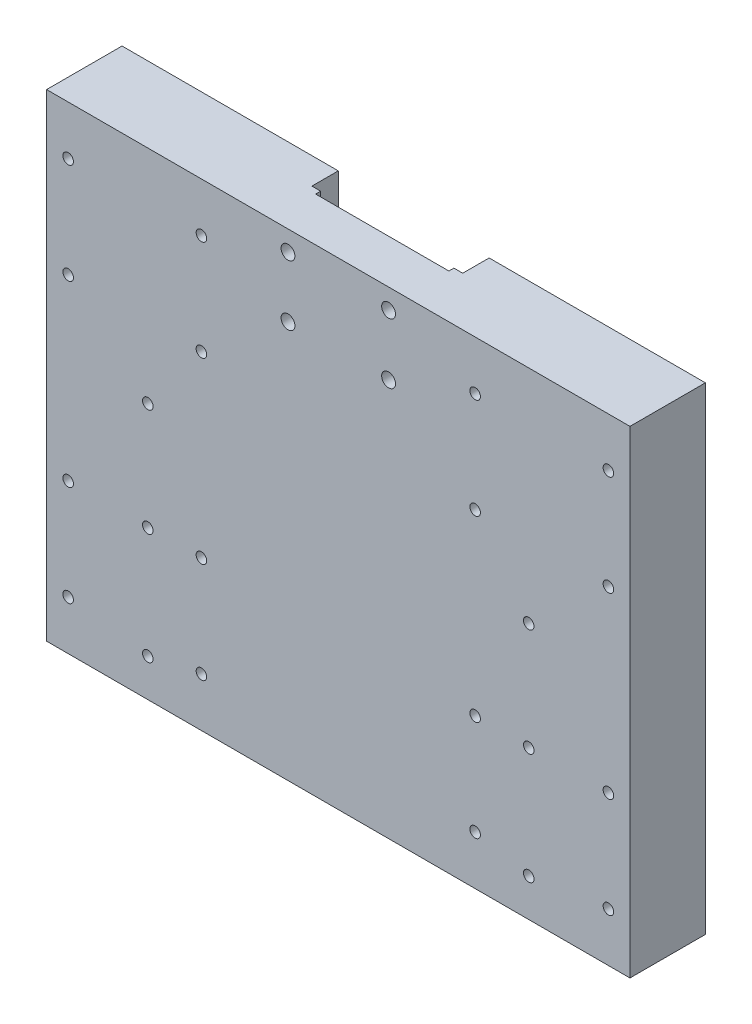
from build123d import *

# Parameters (mm, degrees)
SCHIZZO1_W                   = 232
SCHIZZO1_H                   = 190
ESTRUSIONE_ESTRUSIONE1_DEPTH = 30
SCHIZZO4_W                   = 60
SCHIZZO4_H                   = 10.5
TAGLIO_ESTRUSIONE2_DEPTH     = 225.624130494
TAP_DRILL_FOR_M5_TAP1_D      = 4.2
M5_CLEARANCE_HOLE1_D         = 5.5
TAP_DRILL_FOR_M5_TAP3_D      = 4.2
SKETCH8_W                    = 53
SKETCH8_H                    = 52
CUT_EXTRUDE1_DEPTH           = 2


with BuildPart() as part:
    # Schizzo1 → Estrusione-Estrusione1 (new body)
    with BuildSketch(Plane.XY):
        Rectangle(SCHIZZO1_W, SCHIZZO1_H)
    extrude(amount=ESTRUSIONE_ESTRUSIONE1_DEPTH)

    # Schizzo4 → Taglio-Estrusione2 (cut, through all)
    with BuildSketch(Plane(origin=(0, 95, 0), x_dir=(1, 0, 0), z_dir=(0, 1, 0))):
        with Locations((0, -5.25)):
            Rectangle(SCHIZZO4_W, SCHIZZO4_H)
    extrude(amount=-TAGLIO_ESTRUSIONE2_DEPTH, mode=Mode.SUBTRACT)

    # Tap Drill for M5 Tap1 (through all)
    with Locations(Plane(origin=(0, 0, 0), x_dir=(-1, 0, 0), z_dir=(0, 0, -1))):
        with Locations((-54.428761817, 35.5), (-54.428761817, 75.5), (-107.428761817, 35.5), (-107.428761817, -75.5), (-107.428761817, -35.5), (-54.428761817, -35.5), (-54.428761817, -75.5), (54.428761817, -75.5), (54.428761817, -35.5), (107.428761817, -35.5), (107.428761817, -75.5), (107.428761817, 75.5), (107.428761817, 35.5), (54.428761817, 35.5), (54.428761817, 75.5), (-107.428761817, 75.5)):
            Hole(TAP_DRILL_FOR_M5_TAP1_D / 2)

    # M5 Clearance Hole1 (through all)
    with Locations(Plane.XY.offset(30)):
        with Locations((-20, 87), (20, 87), (20, 63), (-20, 63)):
            Hole(M5_CLEARANCE_HOLE1_D / 2)

    # Tap Drill for M5 Tap3 (through all)
    with Locations(Plane.XY.offset(30)):
        with Locations((-75.75, 7), (-75.75, -80), (75.75, 7), (75.75, -80), (-75.75, -35.79251315), (75.75, -35.79251315)):
            Hole(TAP_DRILL_FOR_M5_TAP3_D / 2)

    # Sketch8 → Cut-Extrude1 (cut)
    with BuildSketch(Plane(origin=(0, 0, 10.5), x_dir=(-1, 0, 0), z_dir=(0, 0, -1))):
        with Locations((0, 69)):
            Rectangle(SKETCH8_W, SKETCH8_H)
    extrude(amount=-CUT_EXTRUDE1_DEPTH, mode=Mode.SUBTRACT)


solid = part.part
